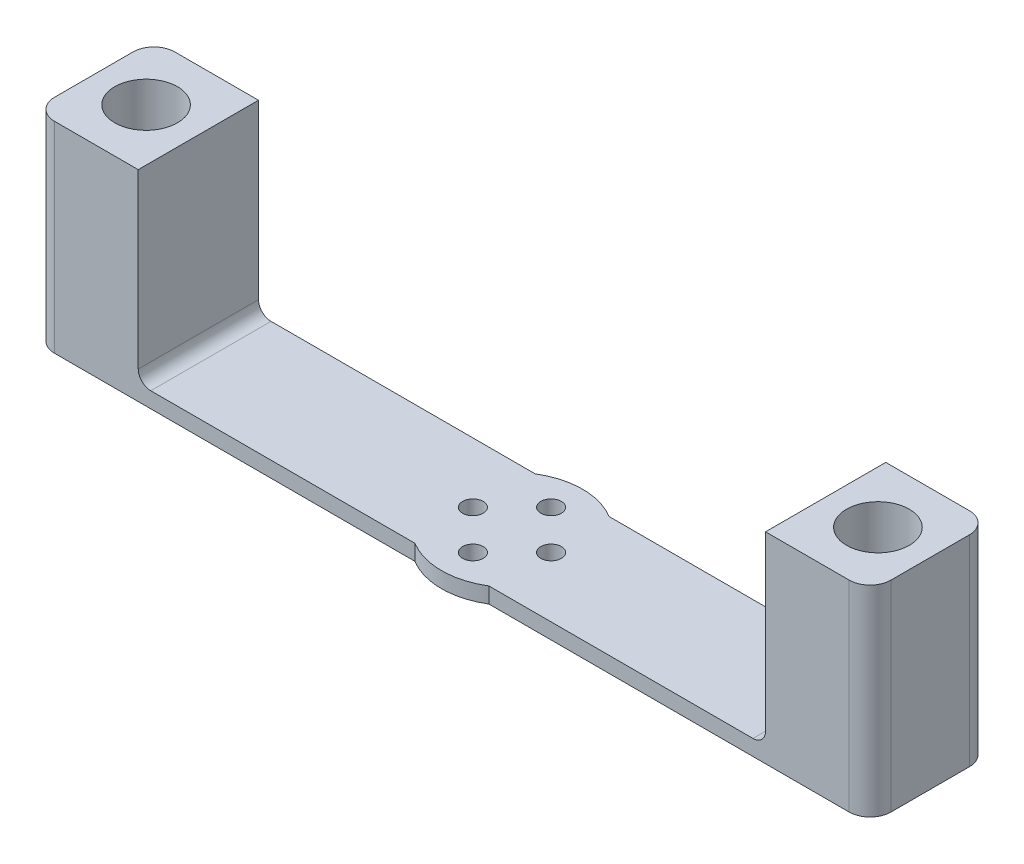
from build123d import *

# Parameters (mm, degrees)
SKETCH1_R                = 17.145
SKETCH1_R_2              = 2.5
BOSS_EXTRUDE1_DEPTH      = 3.81
BOSS_EXTRUDE2_DEPTH      = 45
BOSS_EXTRUDE2_DEPTH_BACK = 3.81
SKETCH2_R                = 7.62
SKETCH2_R_2              = 2.5
CUT_EXTRUDE2_DEPTH       = 118.102684
SKETCH6_R                = 8.89
SKETCH6_R_2              = 4.445
BOSS_EXTRUDE3_DEPTH      = 4.572
FILLET2_R                = 3.048


with BuildPart() as part:
    # Sketch1 → Boss-Extrude1 (new body)
    with BuildSketch(Plane(origin=(0, 0, 0), x_dir=(1, 0, 0), z_dir=(0, 1, 0))):
        with Locations(Location((0, 0, 0), (0, 0, 90))):
            Circle(SKETCH1_R)
        with Locations(Location((0, 9.5, 0), (0, 0, 90))):
            Circle(SKETCH1_R_2, mode=Mode.SUBTRACT)
        with Locations(Location((9.5, 0, 0), (0, 0, 90))):
            Circle(SKETCH1_R_2, mode=Mode.SUBTRACT)
        with Locations(Location((0, -9.5, 0), (0, 0, 90))):
            Circle(SKETCH1_R_2, mode=Mode.SUBTRACT)
        with Locations(Location((-9.5, 0, 0), (0, 0, 90))):
            Circle(SKETCH1_R_2, mode=Mode.SUBTRACT)
    extrude(amount=BOSS_EXTRUDE1_DEPTH)

    # Sketch2 → Boss-Extrude2 (add, two sides: drawn at the far end of the back side and taken through both)
    with BuildSketch(Plane(origin=(0, 3.81, 0), x_dir=(1, 0, 0), z_dir=(0, 1, 0)).offset(-BOSS_EXTRUDE2_DEPTH_BACK)):
        with BuildLine():
            Line((-96.52, -14.605), (96.52, -14.605))
            ThreePointArc((96.52, -14.605), (100.112102448, -13.117102448), (101.6, -9.525))
            Line((101.6, -9.525), (101.6, 9.525))
            ThreePointArc((101.6, 9.525), (100.112102448, 13.117102448), (96.52, 14.605))
            Line((96.52, 14.605), (-96.52, 14.605))
            ThreePointArc((-96.52, 14.605), (-100.112102448, 13.117102448), (-101.6, 9.525))
            Line((-101.6, 9.525), (-101.6, -9.525))
            ThreePointArc((-101.6, -9.525), (-100.112102448, -13.117102448), (-96.52, -14.605))
        make_face()
        with Locations(Location((-88.9, 0, 0), (0, 0, 270))):
            Circle(SKETCH2_R, mode=Mode.SUBTRACT)
        with Locations(Location((88.9, 0, 0), (0, 0, 270))):
            Circle(SKETCH2_R, mode=Mode.SUBTRACT)
        with Locations(Location((9.5, 0, 0), (0, 0, 90))):
            Circle(SKETCH2_R_2, mode=Mode.SUBTRACT)
        with Locations(Location((0, 9.5, 0), (0, 0, 90))):
            Circle(SKETCH2_R_2, mode=Mode.SUBTRACT)
        with Locations(Location((-9.5, 0, 0), (0, 0, 90))):
            Circle(SKETCH2_R_2, mode=Mode.SUBTRACT)
        with Locations(Location((0, -9.5, 0), (0, 0, 90))):
            Circle(SKETCH2_R_2, mode=Mode.SUBTRACT)
    extrude(amount=BOSS_EXTRUDE2_DEPTH + BOSS_EXTRUDE2_DEPTH_BACK)

    # Sketch5 → Cut-Extrude2 (cut, through all)
    with BuildSketch(Plane(origin=(0, 0, -14.605), x_dir=(-1, 0, 0), z_dir=(0, 0, -1))):
        Polygon((-76.2, 3.81), (0, 3.81), (76.2, 3.81), (76.2, 48.81), (-76.2, 48.81), align=None)
    extrude(amount=-CUT_EXTRUDE2_DEPTH, mode=Mode.SUBTRACT)

    # Sketch6 → Boss-Extrude3 (add)
    # profile 1 of 2: a face of its own
    with BuildSketch(Plane.XZ):
        with Locations((-88.9, 0)):
            Circle(SKETCH6_R)
        with Locations(Location((-88.9, 0, 0), (0, 0, 270))):
            Circle(SKETCH6_R_2, mode=Mode.SUBTRACT)
    # profile 2 of 2: a face of its own
    with BuildSketch(Plane.XZ):
        with Locations((88.9, 0)):
            Circle(SKETCH6_R)
        with Locations(Location((88.9, 0, 0), (0, 0, 270))):
            Circle(SKETCH6_R_2, mode=Mode.SUBTRACT)
    extrude(amount=-BOSS_EXTRUDE3_DEPTH)

    # Fillet2
    fillet2_edges = [part.edges().sort_by_distance(p)[0] for p in [
        (-76.2, 3.81, 0),
        (76.2, 3.81, 0),
    ]]
    fillet(fillet2_edges, radius=FILLET2_R)


solid = part.part
